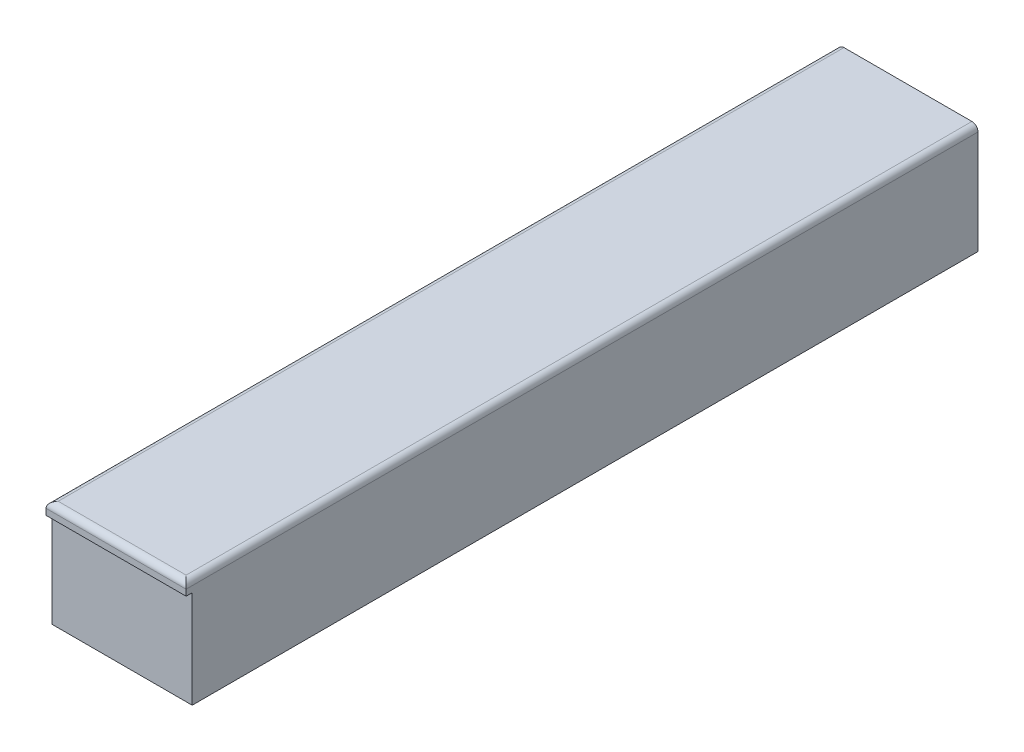
from build123d import *

# Parameters (mm, degrees)
SALIENTE_EXTRUIR1_DEPTH = 18
CROQUIS3_W              = 23
CROQUIS3_H              = 16
CORTAR_EXTRUIR1_DEPTH   = 1
REDONDEO1_R             = 1


with BuildPart() as part:
    # Croquis2 → Saliente-Extruir1 (new body)
    with BuildSketch(Plane(origin=(0, 0, 0), x_dir=(1, 0, 0), z_dir=(0, 1, 0))):
        Polygon((0, 130), (0, 0), (23, 0), (23, 50), (23, 130), (14, 130), align=None)
    extrude(amount=SALIENTE_EXTRUIR1_DEPTH)

    # Croquis3 → Cortar-Extruir1 (cut)
    with BuildSketch(Plane.XY):
        with Locations((11.5, 8)):
            Rectangle(CROQUIS3_W, CROQUIS3_H)
    extrude(amount=-CORTAR_EXTRUIR1_DEPTH, mode=Mode.SUBTRACT)

    # Redondeo1
    redondeo1_edges = [part.edges().sort_by_distance(p)[0] for p in [
        (0, 18, -65),
        (11.5, 18, 0),
        (23, 18, -65),
    ]]
    fillet(redondeo1_edges, radius=REDONDEO1_R)


solid = part.part
